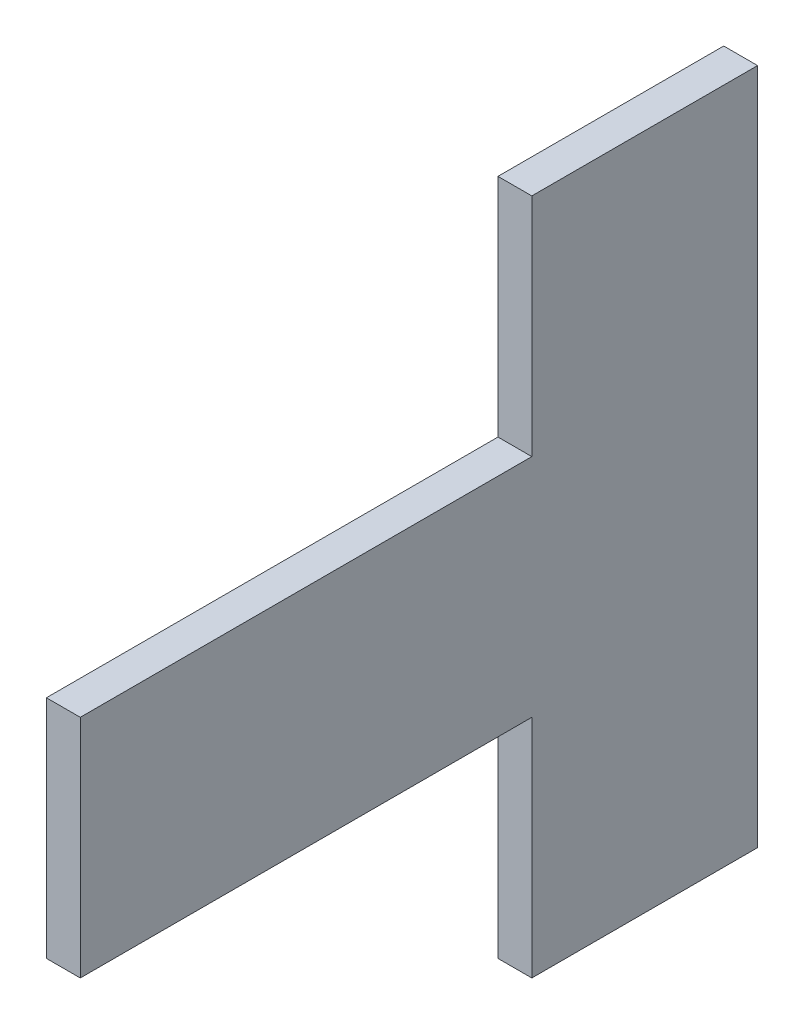
from build123d import *

# Parameters (mm, degrees)
BOSS_EXTRUDE1_DEPTH = 3.81


with BuildPart() as part:
    # Sketch1 → Boss-Extrude1 (new body)
    with BuildSketch(Plane(origin=(0, 0, 0), x_dir=(0, 0, -1), z_dir=(1, 0, 0))):
        Polygon((0, 0), (-50.8, 0), (-50.8, -25.4), (0, -25.4), (0, -50.8), (25.4, -50.8), (25.4, 25.4), (0, 25.4), align=None)
    extrude(amount=BOSS_EXTRUDE1_DEPTH)


solid = part.part
